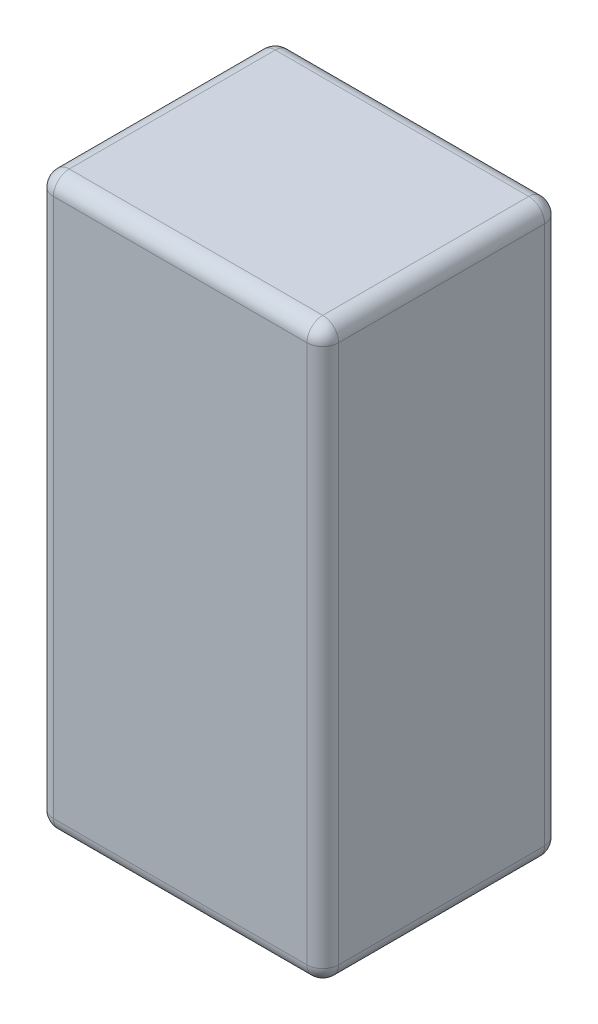
from build123d import *

# Parameters (mm, degrees)
CROQUIS1_W              = 36
CROQUIS1_H              = 30
SALIENTE_EXTRUIR1_DEPTH = 72
REDONDEO1_R             = 2


with BuildPart() as part:
    # Croquis1 → Saliente-Extruir1 (new body)
    with BuildSketch(Plane(origin=(0, 0, 0), x_dir=(1, 0, 0), z_dir=(0, 1, 0))):
        Rectangle(CROQUIS1_W, CROQUIS1_H)
    extrude(amount=SALIENTE_EXTRUIR1_DEPTH)

    # Redondeo1
    redondeo1_edges = [part.edges().sort_by_distance(p)[0] for p in [
        (18, 72, 0),
        (0, 72, -15),
        (-18, 72, 0),
        (0, 0, -15),
        (18, 0, 0),
        (0, 0, 15),
        (-18, 0, 0),
        (0, 72, 15),
        (-18, 36, -15),
        (18, 36, -15),
        (18, 36, 15),
        (-18, 36, 15),
    ]]
    fillet(redondeo1_edges, radius=REDONDEO1_R)


solid = part.part
